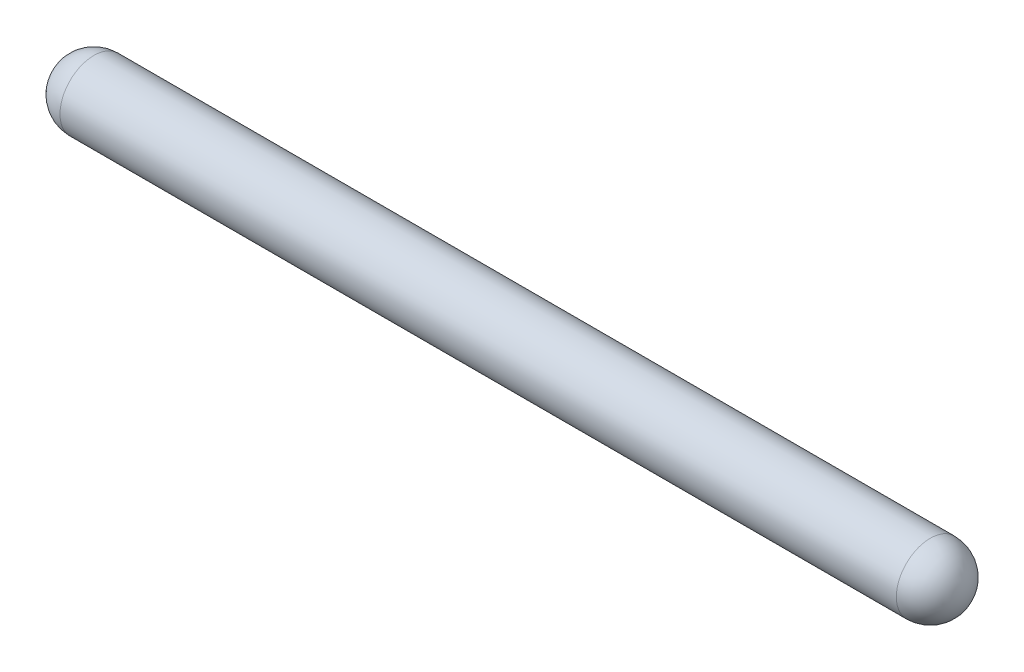
from build123d import *

# Parameters (mm, degrees)
SKETCH1_R           = 2.38125
BOSS_EXTRUDE1_DEPTH = 63.5
FILLET1_R           = 2.38125


with BuildPart() as part:
    # Sketch1 → Boss-Extrude1 (new body)
    with BuildSketch(Plane(origin=(0, 0, 0), x_dir=(0, 0, -1), z_dir=(1, 0, 0))):
        Circle(SKETCH1_R)
    extrude(amount=BOSS_EXTRUDE1_DEPTH)

    # Fillet1
    fillet1_edges = [part.edges().sort_by_distance(p)[0] for p in [
        (0, 0, 2.38125),
        (63.5, 0, 2.38125),
    ]]
    fillet(fillet1_edges, radius=FILLET1_R)


solid = part.part
